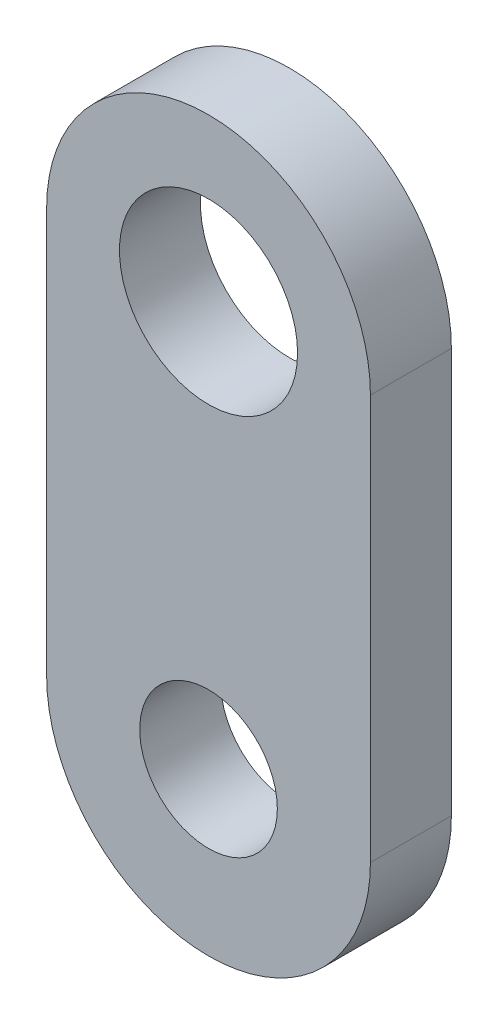
from build123d import *

# Parameters (mm, degrees)
SKETCH1_R           = 11
SKETCH1_R_2         = 8.5
BOSS_EXTRUDE1_DEPTH = 10


with BuildPart() as part:
    # Sketch1 → Boss-Extrude1 (new body)
    with BuildSketch(Plane.XY):
        with BuildLine():
            Line((20, 25), (20, -25))
            ThreePointArc((20, -25), (0, -45), (-20, -25))
            Line((-20, -25), (-20, 25))
            ThreePointArc((-20, 25), (0, 45), (20, 25))
        make_face()
        with Locations((0, 25)):
            Circle(SKETCH1_R, mode=Mode.SUBTRACT)
        with Locations((0, -25)):
            Circle(SKETCH1_R_2, mode=Mode.SUBTRACT)
    extrude(amount=BOSS_EXTRUDE1_DEPTH)


solid = part.part
